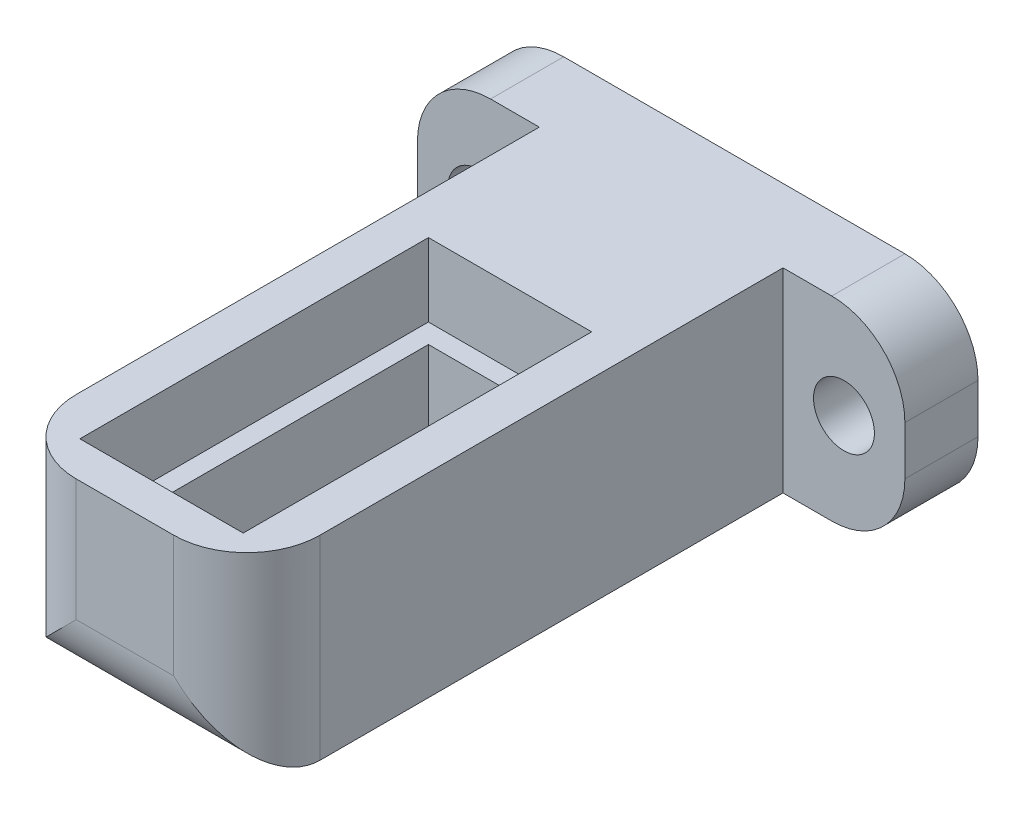
from build123d import *

# Parameters (mm, degrees)
ESBO_O1_W                = 10
ESBO_O1_H                = 25
RESSALTO_EXTRUS_O1_DEPTH = 8
ESBO_O2_W                = 6.7
ESBO_O2_H                = 14.3
CORTE_EXTRUS_O1_DEPTH    = 3
ESBO_O3_W                = 5
ESBO_O3_H                = 8
RESSALTO_EXTRUS_O2_DEPTH = 3
ESBO_O5_R                = 1.25
CORTE_EXTRUS_O2_DEPTH    = 26.455844123
FILETE1_R                = 3
FILETE1_OF_ESPELHAR3_R   = 3
ESBO_O6_W                = 5.1
ESBO_O6_H                = 12.7
CORTE_EXTRUS_O3_DEPTH    = 3
ESBO_O7_R                = 2
CORTE_EXTRUS_O4_DEPTH    = 18.095320997
FILETE2_R                = 3


with BuildPart() as part:
    # Esboço1 → Ressalto-extrusão1 (new body)
    with BuildSketch(Plane(origin=(0, 0, 0), x_dir=(1, 0, 0), z_dir=(0, 1, 0))):
        Rectangle(ESBO_O1_W, ESBO_O1_H)
    extrude(amount=RESSALTO_EXTRUS_O1_DEPTH)

    # Esboço2 → Corte-extrusão1 (cut)
    with BuildSketch(Plane(origin=(0, 8, 0), x_dir=(1, 0, 0), z_dir=(0, 1, 0))):
        with Locations((0, -3.85)):
            Rectangle(ESBO_O2_W, ESBO_O2_H)
    extrude(amount=-CORTE_EXTRUS_O1_DEPTH, mode=Mode.SUBTRACT)

    # Esboço3 → Ressalto-extrusão2 (add)
    with BuildSketch(Plane(origin=(0, 0, -12.5), x_dir=(-1, 0, 0), z_dir=(0, 0, -1))):
        with Locations((-7.5, 4)):
            Rectangle(ESBO_O3_W, ESBO_O3_H)
    ressalto_extrus_o2 = extrude(amount=-RESSALTO_EXTRUS_O2_DEPTH)

    # Esboço5 → Corte-extrusão2 (cut, through all)
    with BuildSketch(Plane.XY.offset(-9.5)):
        with Locations((7.5, 4)):
            Circle(ESBO_O5_R)
    corte_extrus_o2 = extrude(amount=-CORTE_EXTRUS_O2_DEPTH, mode=Mode.SUBTRACT)

    # Filete1
    filete1_edges = [part.edges().sort_by_distance(p)[0] for p in [
        (10, 0, -11),
        (10, 8, -11),
    ]]
    fillet(filete1_edges, radius=FILETE1_R)

    # Espelhar3: Ressalto-extrusão2, Corte-extrusão2 across plane
    add(ressalto_extrus_o2.mirror(Plane(origin=(0, 0, 0), x_dir=(0, 0, 1), z_dir=(1, 0, 0))))
    add(corte_extrus_o2.mirror(Plane(origin=(0, 0, 0), x_dir=(0, 0, 1), z_dir=(1, 0, 0))), mode=Mode.SUBTRACT)

    # Filete1 of Espelhar3
    filete1_of_espelhar3_edges = [part.edges().sort_by_distance(p)[0] for p in [
        (-10, 0, -11),
        (-10, 8, -11),
    ]]
    fillet(filete1_of_espelhar3_edges, radius=FILETE1_OF_ESPELHAR3_R)

    # Esboço6 → Corte-extrusão3 (cut)
    with BuildSketch(Plane(origin=(0, 5, 0), x_dir=(1, 0, 0), z_dir=(0, 1, 0))):
        with Locations((0, -3.85)):
            Rectangle(ESBO_O6_W, ESBO_O6_H)
    extrude(amount=-CORTE_EXTRUS_O3_DEPTH, mode=Mode.SUBTRACT)

    # Esboço7 → Corte-extrusão4 (cut, through all)
    with BuildSketch(Plane(origin=(0, 2, 0), x_dir=(1, 0, 0), z_dir=(0, 1, 0))):
        with Locations(Location((0, -0.5, 0), (0, 0, 270))):
            Circle(ESBO_O7_R)
    extrude(amount=-CORTE_EXTRUS_O4_DEPTH, mode=Mode.SUBTRACT)

    # Filete2
    filete2_edges = [part.edges().sort_by_distance(p)[0] for p in [
        (0, 0, 12.5),
        (5, 4, 12.5),
        (-5, 4, 12.5),
    ]]
    fillet(filete2_edges, radius=FILETE2_R)


solid = part.part
